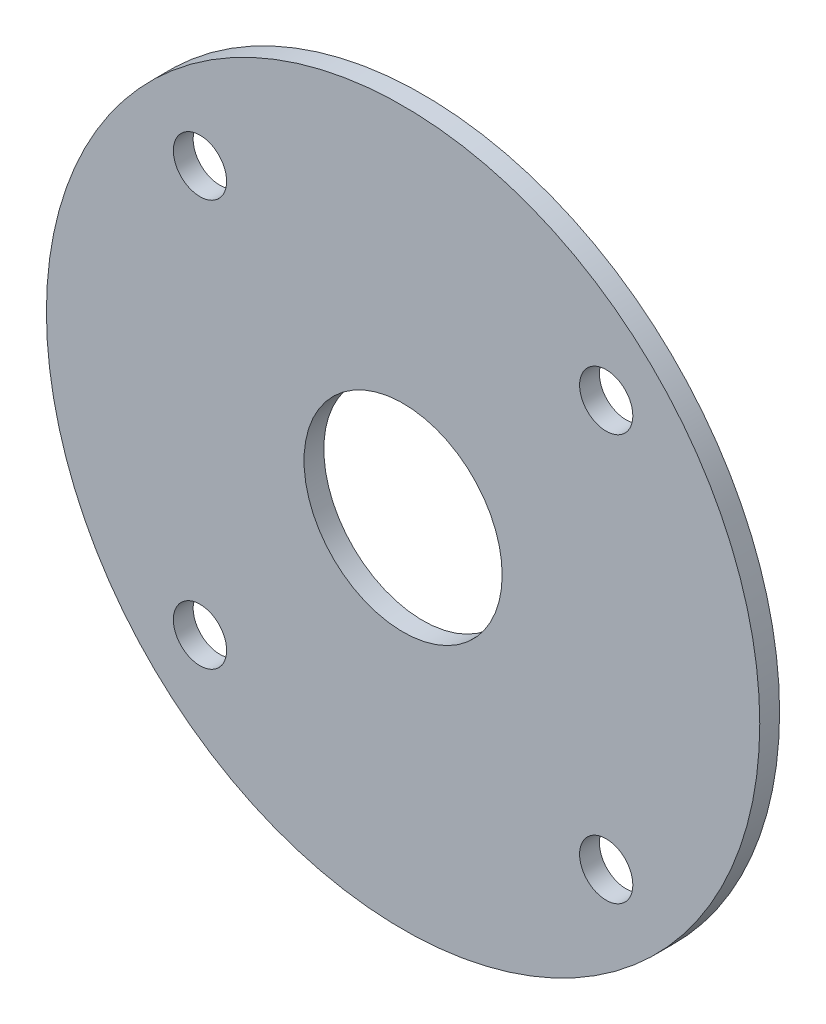
from build123d import *

# Parameters (mm, degrees)
SKETCH2_R          = 114.3
SKETCH2_R_2        = 31.75
EXTRUDE1_DEPTH     = 6.35
CUT_EXTRUDE1_REACH = 163.769
SKETCH3_R          = 8.5328125


with BuildPart() as part:
    # Sketch2 → Extrude1 (new body)
    with BuildSketch(Plane.XY):
        Circle(SKETCH2_R)
        Circle(SKETCH2_R_2, mode=Mode.SUBTRACT)
    extrude(amount=EXTRUDE1_DEPTH)

    # Sketch3 → Cut-Extrude1 (cut, up to next)
    with BuildSketch(Plane.XY.offset(6.35), mode=Mode.PRIVATE) as cut_extrude1_sk1:
        with Locations((-65.0875, -65.0875)):
            Circle(SKETCH3_R)
    cut_extrude1_tool1 = extrude(cut_extrude1_sk1.sketch, amount=-CUT_EXTRUDE1_REACH, mode=Mode.PRIVATE) & part.part
    # Sketch3 → Cut-Extrude1 (cut, up to next)
    with BuildSketch(Plane.XY.offset(6.35), mode=Mode.PRIVATE) as cut_extrude1_sk2:
        with Locations((-65.0875, 65.0875)):
            Circle(SKETCH3_R)
    cut_extrude1_tool2 = extrude(cut_extrude1_sk2.sketch, amount=-CUT_EXTRUDE1_REACH, mode=Mode.PRIVATE) & part.part
    # Sketch3 → Cut-Extrude1 (cut, up to next)
    with BuildSketch(Plane.XY.offset(6.35), mode=Mode.PRIVATE) as cut_extrude1_sk3:
        with Locations((65.0875, 65.0875)):
            Circle(SKETCH3_R)
    cut_extrude1_tool3 = extrude(cut_extrude1_sk3.sketch, amount=-CUT_EXTRUDE1_REACH, mode=Mode.PRIVATE) & part.part
    # Sketch3 → Cut-Extrude1 (cut, up to next)
    with BuildSketch(Plane.XY.offset(6.35), mode=Mode.PRIVATE) as cut_extrude1_sk4:
        with Locations((65.0875, -65.0875)):
            Circle(SKETCH3_R)
    cut_extrude1_tool4 = extrude(cut_extrude1_sk4.sketch, amount=-CUT_EXTRUDE1_REACH, mode=Mode.PRIVATE) & part.part
    add(cut_extrude1_tool1.solids().sort_by_distance((-65.0875, -65.0875, 6.35))[0], mode=Mode.SUBTRACT)
    add(cut_extrude1_tool2.solids().sort_by_distance((-65.0875, 65.0875, 6.35))[0], mode=Mode.SUBTRACT)
    add(cut_extrude1_tool3.solids().sort_by_distance((65.0875, 65.0875, 6.35))[0], mode=Mode.SUBTRACT)
    add(cut_extrude1_tool4.solids().sort_by_distance((65.0875, -65.0875, 6.35))[0], mode=Mode.SUBTRACT)


solid = part.part
